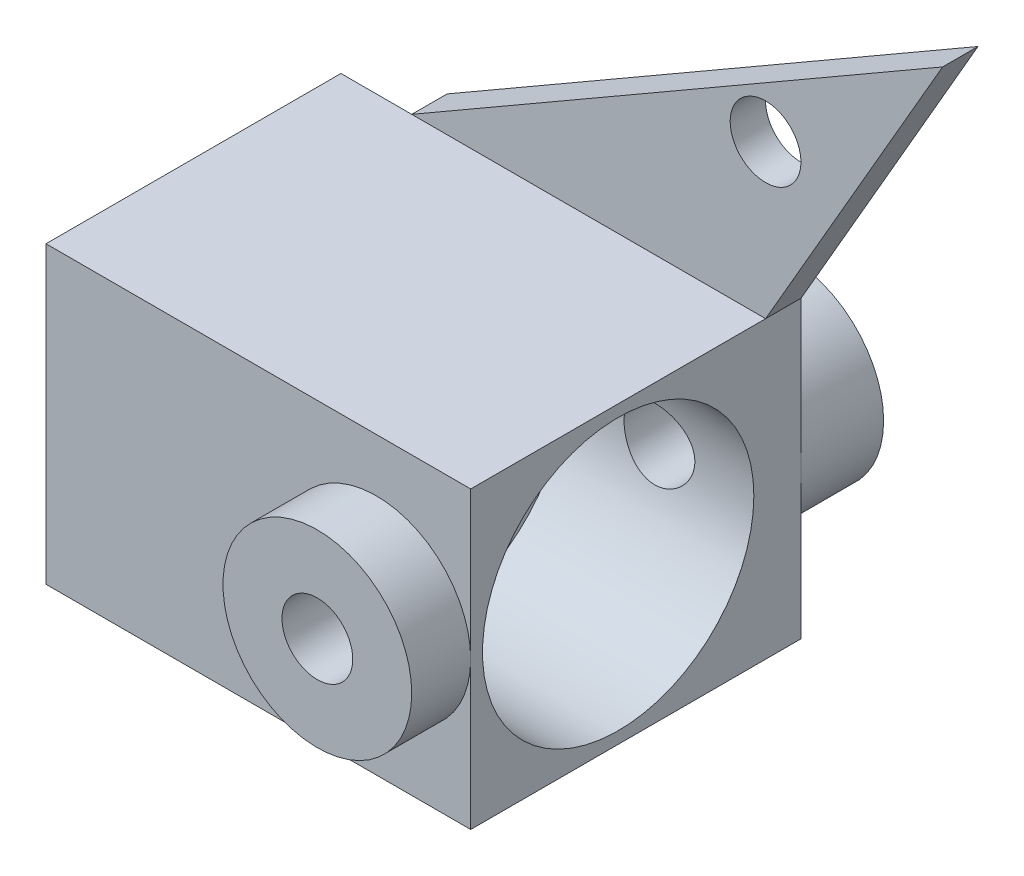
from build123d import *

# Parameters (mm, degrees)
SKETCH_1_W          = 35
SKETCH_1_H          = 25
SKETCH_1_R          = 8
EXTRUDE_2_DEPTH     = 25
SKETCH_2_R          = 8
EXTRUDE_3_DEPTH     = 5
EXTRUDE_START       = 10
SKETCH_3_R          = 8
EXTRUDE_4_DEPTH     = 10
SKETCH_4_R          = 3
CUT_EXTRUDE_1_DEPTH = 46.414755311
SKETCH_5_R          = 11.5
CUT_EXTRUDE_2_DEPTH = 16
SKETCH_6_R          = 4
EXTRUDE_5_DEPTH     = 15
SKETCH_8_W          = 3
SKETCH_8_H          = 2.025472792
CUT_EXTRUDE_3_DEPTH = 15
EXTRUDE_START_2     = -2
SKETCH_9_R          = 4
EXTRUDE_6_DEPTH     = 2
SKETCH_10_R         = 4
EXTRUDE_7_DEPTH     = 2
EXTRUDE_START_3     = 3
SKETCH_12_R         = 3
SKETCH_12_R_2       = 8
EXTRUDE_11_DEPTH    = 3
SKETCH_14_W         = 6.627877622
SKETCH_14_H         = 25
CUT_EXTRUDE_4_DEPTH = 3
SKETCH_15_R         = 3
EXTRUDE_12_DEPTH    = 3
SKETCH_16_W         = 54.108486571
SKETCH_16_H         = 30.150888104
CUT_EXTRUDE_5_DEPTH = 59.626095374
SKETCH_17_W         = 25
SKETCH_17_H         = 25
CUT_EXTRUDE_6_DEPTH = 70.862501092
SKETCH_18_W         = 25
SKETCH_18_H         = 25
SKETCH_18_R         = 4
EXTRUDE_13_DEPTH    = 1


with BuildPart() as part:
    # 草图1 → 凸台-拉伸2 (new body)
    # profile 1 of 2: a face of its own
    with BuildSketch(Plane.XY):
        Rectangle(SKETCH_1_W, SKETCH_1_H)
        with Locations((9.5, 0)):
            Circle(SKETCH_1_R, mode=Mode.SUBTRACT)
    # profile 2 of 2: a face of its own
    with BuildSketch(Plane.XY):
        with Locations((9.5, 0)):
            Circle(SKETCH_1_R)
    extrude(amount=EXTRUDE_2_DEPTH)

    # 草图2 → 凸台-拉伸3 (add)
    with BuildSketch(Plane.XY.offset(25)):
        with Locations((9.5, 0)):
            Circle(SKETCH_2_R)
    extrude(amount=EXTRUDE_3_DEPTH)

    # 草图3 → 凸台-拉伸4 (add)
    with BuildSketch(Plane(origin=(0, 0, 0), x_dir=(-1, 0, 0), z_dir=(0, 0, -1)).offset(EXTRUDE_START)):
        with Locations(Location((-9.5, 0, 0), (0, 0, 180))):
            Circle(SKETCH_3_R)
    extrude(amount=-EXTRUDE_4_DEPTH)

    # 草图4 → 切除-拉伸1 (cut, through all)
    with BuildSketch(Plane.XY.offset(30)):
        with Locations((9.5, 0)):
            Circle(SKETCH_4_R)
    extrude(amount=-CUT_EXTRUDE_1_DEPTH, mode=Mode.SUBTRACT)

    # 草图5 → 切除-拉伸2 (cut)
    with BuildSketch(Plane(origin=(17.5, 0, 0), x_dir=(0, 0, -1), z_dir=(1, 0, 0))):
        with Locations((-12.5, 0)):
            Circle(SKETCH_5_R)
    extrude(amount=-CUT_EXTRUDE_2_DEPTH, mode=Mode.SUBTRACT)

    # 草图6 → 凸台-拉伸5 (add)
    with BuildSketch(Plane.ZY.offset(17.5)):
        with Locations((12.5, 0)):
            Circle(SKETCH_6_R)
    extrude(amount=EXTRUDE_5_DEPTH)

    # 草图8 → 切除-拉伸3 (cut)
    with BuildSketch(Plane.ZY.offset(17.5)):
        with Locations((17, 0)):
            Rectangle(SKETCH_8_W, SKETCH_8_H)
    extrude(amount=CUT_EXTRUDE_3_DEPTH, mode=Mode.SUBTRACT)

    # 草图9 → 凸台-拉伸6 (add)
    with BuildSketch(Plane.ZY.offset(32.5).offset(EXTRUDE_START_2)):
        with Locations(Location((12.5, 0, 0), (0, 0, 14.666011097))):
            Circle(SKETCH_9_R)
    extrude(amount=EXTRUDE_6_DEPTH)

    # 草图10 → 凸台-拉伸7 (add)
    with BuildSketch(Plane.ZY.offset(17.5)):
        with Locations((12.5, 0)):
            Circle(SKETCH_10_R)
    extrude(amount=EXTRUDE_7_DEPTH)

    # 草图12 → 凸台-拉伸11 (add)
    with BuildSketch(Plane(origin=(0, 0, 0), x_dir=(-1, 0, 0), z_dir=(0, 0, -1)).offset(EXTRUDE_START_3)):
        Polygon((12.5, 12.5), (-24.127877622, 12.5), (-24.127877622, -12.5), (-17.5, -12.5), (-32.5, -38.480762114), (12.5, -12.5), align=None)
        with Locations((-17.5, -25.490381057)):
            Circle(SKETCH_12_R, mode=Mode.SUBTRACT)
        with Locations(Location((-9.5, 0, 0), (0, 0, 180))):
            Circle(SKETCH_12_R_2, mode=Mode.SUBTRACT)
    extrude(amount=-EXTRUDE_11_DEPTH)

    # 草图14 → 切除-拉伸4 (cut)
    with BuildSketch(Plane.XY):
        with Locations((20.813938811, 0)):
            Rectangle(SKETCH_14_W, SKETCH_14_H)
    extrude(amount=-CUT_EXTRUDE_4_DEPTH, mode=Mode.SUBTRACT)

    # 草图15 → 凸台-拉伸12 (add)
    with BuildSketch(Plane(origin=(0, 0, -3), x_dir=(-1, 0, 0), z_dir=(0, 0, -1))):
        Polygon((-17.5, 12.5), (-32.5, 38.480762114), (12.5, 12.5), align=None)
        with Locations((-17.491669751, 25.485571585)):
            Circle(SKETCH_15_R, mode=Mode.SUBTRACT)
    extrude(amount=-EXTRUDE_12_DEPTH)

    # 草图16 → 切除-拉伸5 (cut, through all)
    with BuildSketch(Plane.XY):
        with Locations((14.554243286, -27.575444052)):
            Rectangle(SKETCH_16_W, SKETCH_16_H)
    extrude(amount=-CUT_EXTRUDE_5_DEPTH, mode=Mode.SUBTRACT)

    # 草图17 → 切除-拉伸6 (cut, through all)
    with BuildSketch(Plane.ZY.offset(17.5)):
        with Locations((12.5, 0)):
            Rectangle(SKETCH_17_W, SKETCH_17_H)
    extrude(amount=CUT_EXTRUDE_6_DEPTH, mode=Mode.SUBTRACT)

    # 草图18 → 凸台-拉伸13 (add)
    with BuildSketch(Plane.ZY.offset(17.5)):
        with Locations((12.5, 0)):
            Rectangle(SKETCH_18_W, SKETCH_18_H)
        with Locations((12.5, 0)):
            Circle(SKETCH_18_R, mode=Mode.SUBTRACT)
    extrude(amount=EXTRUDE_13_DEPTH)


solid = part.part
